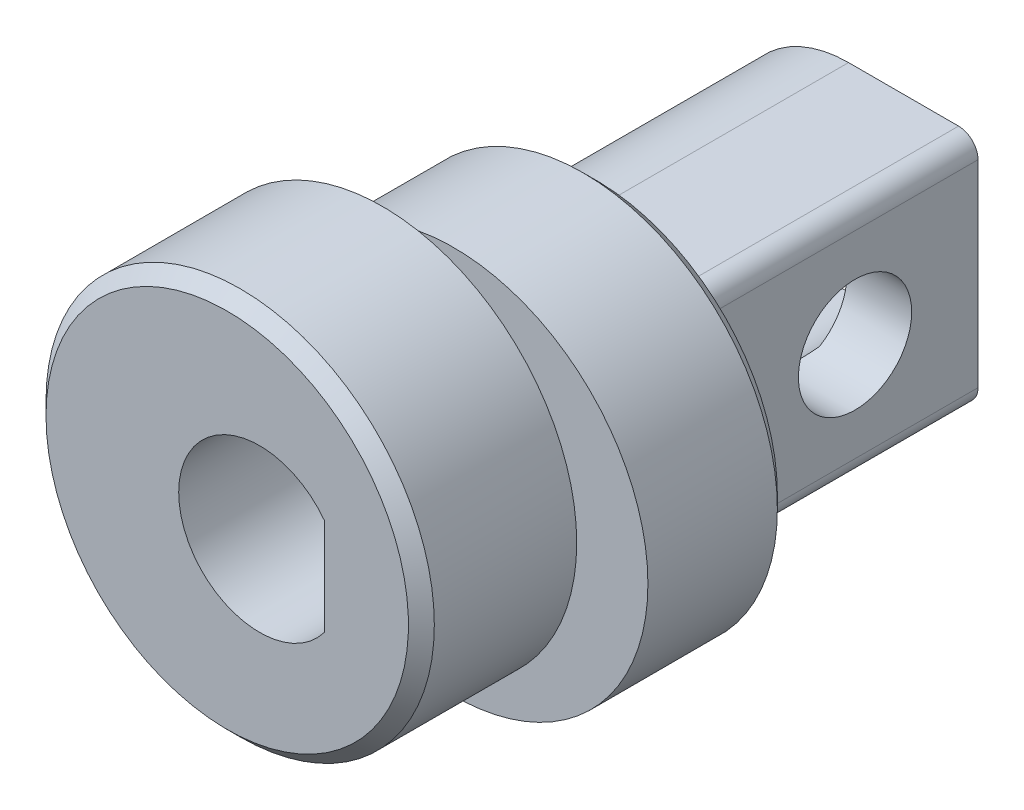
from build123d import *

# Parameters (mm, degrees)
BOSS_EXTRUDE4_DEPTH            = 4.2
BOSS_EXTRUDE4_DEPTH_BACK       = 0.2
SKETCH10_R                     = 6
BOSS_EXTRUDE5_DEPTH            = 9
SKETCH16_R                     = 6
BOSS_EXTRUDE6_DEPTH            = 4.8
CUT_EXTRUDE2_DEPTH             = 21.471443525
F_3_5_3_5_DIAMETER_HOLE0_D     = 3.5
F_3_5_3_5_DIAMETER_HOLE0_DEPTH = 4
F_3_5_3_5_DIAMETER_HOLE0_TIP   = 1.051506083
CHAMFER2_SIZE                  = 0.4


with BuildPart() as part:
    # Sketch10 → Boss-Extrude4 (new, two sides: drawn at the far end of the back side and taken through both)
    with BuildSketch(Plane.XY.offset(0.4).offset(-BOSS_EXTRUDE4_DEPTH_BACK)):
        with Locations((1.2, 0)):
            Circle(SKETCH10_R)
    extrude(amount=BOSS_EXTRUDE4_DEPTH + BOSS_EXTRUDE4_DEPTH_BACK)

    # Sketch11 → Boss-Extrude5 (add)
    with BuildSketch(Plane(origin=(0, 0, 0.2), x_dir=(-1, 0, 0), z_dir=(0, 0, -1))):
        with BuildLine():
            Line((-4, -3.05), (-4, 3.05))
            ThreePointArc((-4, 3.05), (-3.824264069, 3.474264069), (-3.4, 3.65))
            Line((-3.4, 3.65), (0, 3.65))
            ThreePointArc((0, 3.65), (3.65, 0), (0, -3.65))
            Line((0, -3.65), (-3.4, -3.65))
            ThreePointArc((-3.4, -3.65), (-3.824264069, -3.474264069), (-4, -3.05))
        make_face()
    extrude(amount=BOSS_EXTRUDE5_DEPTH)

    # Sketch16 → Boss-Extrude6 (add)
    with BuildSketch(Plane(origin=(0, 0, 4.6), x_dir=(-1, 0, 0), z_dir=(0, 0, -1))):
        with Locations((1, 0)):
            Circle(SKETCH16_R)
    extrude(amount=-BOSS_EXTRUDE6_DEPTH)

    # Sketch17 → Cut-Extrude2 (cut, through all)
    with BuildSketch(Plane.XY.offset(9.4)):
        with BuildLine():
            Line((2, -1.5), (2, 1.5))
            ThreePointArc((2, 1.5), (-2.5, 0), (2, -1.5))
        make_face()
    extrude(amount=-CUT_EXTRUDE2_DEPTH, mode=Mode.SUBTRACT)

    # Ø3.5 (3.5) Diameter Hole0
    with Locations(Plane(origin=(4, 0, 0), x_dir=(0, 0, -1), z_dir=(1, 0, 0))):
        with Locations((5, 0)):
            Hole(F_3_5_3_5_DIAMETER_HOLE0_D / 2, depth=F_3_5_3_5_DIAMETER_HOLE0_DEPTH)
            with Locations((0, 0, -(F_3_5_3_5_DIAMETER_HOLE0_DEPTH + F_3_5_3_5_DIAMETER_HOLE0_TIP / 2))):  # 118° drill point
                Cone(0, F_3_5_3_5_DIAMETER_HOLE0_D / 2, F_3_5_3_5_DIAMETER_HOLE0_TIP, mode=Mode.SUBTRACT)

    # Chamfer2
    chamfer2_edges = [part.edges().sort_by_distance(p)[0] for p in [
        (5, 0, 9.4),
        (-4.8, 0, 0.2),
    ]]
    chamfer(chamfer2_edges, length=CHAMFER2_SIZE)


solid = part.part
